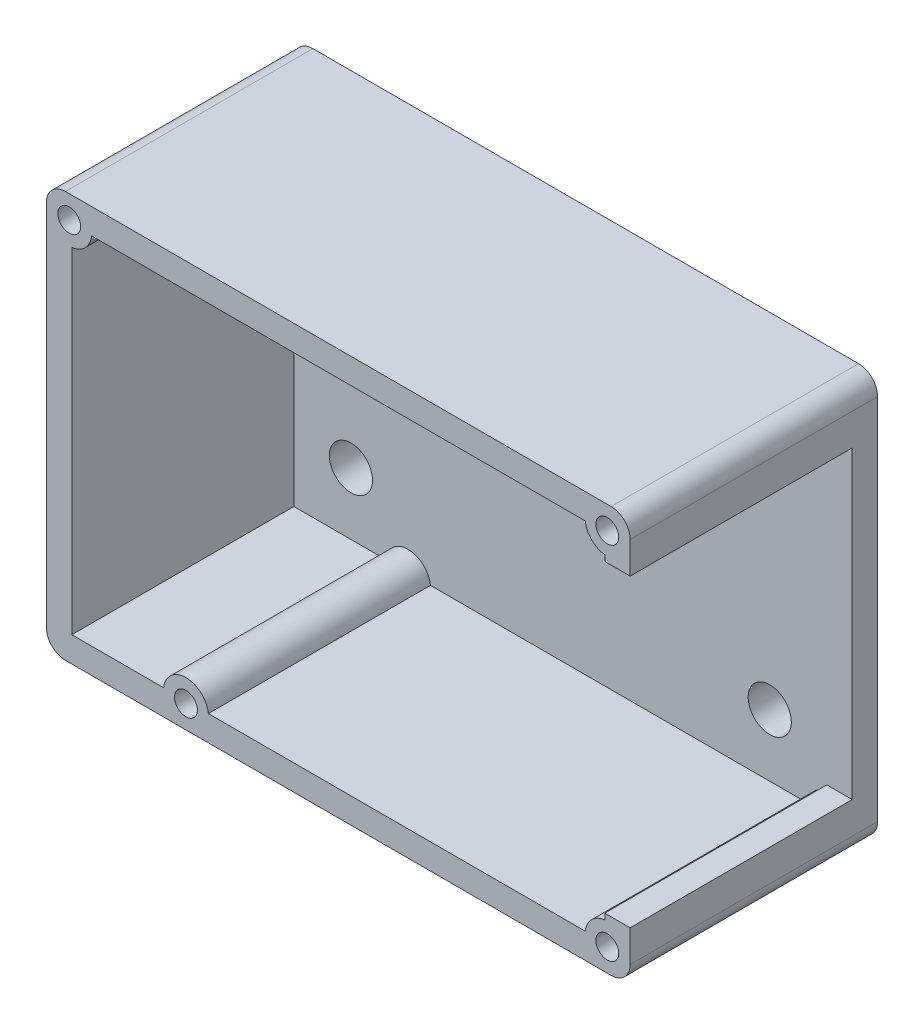
from build123d import *

# Parameters (mm, degrees)
SKETCH2_W                       = 46
SKETCH2_H                       = 32
BOSS_EXTRUDE1_DEPTH             = 19.5
SHELL1_T                        = -2
CBORE_FOR_M3_SBHCS1_AT_2_COUNT  = 2
CBORE_FOR_M3_SBHCS1_AT_2_PITCH  = 18.114862856
CBORE_FOR_M3_SBHCS1_AT_3_COUNT  = 2
CBORE_FOR_M3_SBHCS1_AT_3_PITCH  = 37.645029636
CBORE_FOR_M3_SBHCS1_AT_4_COUNT  = 2
CBORE_FOR_M3_SBHCS1_AT_4_PITCH  = 33
SKETCH8_R                       = 3.35
SKETCH8_R_2                     = 1.7
BOSS_EXTRUDE2_DEPTH             = 3.63
SKETCH9_R                       = 5
BOSS_EXTRUDE3_DEPTH             = 2
SKETCH10_W                      = 17.5
SKETCH10_H                      = 24
CUT_EXTRUDE1_DEPTH              = 2
CBORE_FOR_M1_6_SHCS1_AT_2_COUNT = 2
CBORE_FOR_M1_6_SHCS1_AT_2_PITCH = 42.4
CBORE_FOR_M1_6_SHCS1_AT_3_COUNT = 2
CBORE_FOR_M1_6_SHCS1_AT_3_PITCH = 43.689815747
CBORE_FOR_M1_6_SHCS1_AT_4_COUNT = 2
CBORE_FOR_M1_6_SHCS1_AT_4_PITCH = 28.4
SKETCH14_R                      = 1.75
SKETCH14_R_2                    = 0.9
SKETCH14_R_3                    = 1.775
BOSS_EXTRUDE4_DEPTH             = 17.9
FILLET1_R                       = 1.5


with BuildPart() as part:
    # Sketch2 → Boss-Extrude1 (new body)
    with BuildSketch(Plane.XY):
        with Locations((-23, -16)):
            Rectangle(SKETCH2_W, SKETCH2_H)
    extrude(amount=BOSS_EXTRUDE1_DEPTH)

    # Shell1
    shell1_openings = [part.faces().sort_by_distance(p)[0] for p in [
        (-23, -16, 19.5),
    ]]
    offset(amount=SHELL1_T, openings=shell1_openings, kind=Kind.INTERSECTION)

    # Sketch5 → CBORE for M3 SBHCS1 (revolve, cut)
    with BuildSketch(Plane(origin=(-6.5, -7, 0), x_dir=(0, 1, 0), z_dir=(1, 0, 0))):
        Polygon((0, 0), (0, 3.021463052), (1.7, 2), (1.7, 1.65), (3.35, 1.65), (3.35, 0.025), (3.375, 0), align=None)
    cbore_for_m3_sbhcs1 = revolve(axis=Axis((-6.5, -7, -6.35), (0, 0, 1)), mode=Mode.SUBTRACT)

    # CBORE for M3 SBHCS1 at 2: CBORE for M3 SBHCS1 ×2
    with Locations(*[(0, -i * CBORE_FOR_M3_SBHCS1_AT_2_PITCH, 0) for i in range(1, CBORE_FOR_M3_SBHCS1_AT_2_COUNT)]):
        add(cbore_for_m3_sbhcs1, mode=Mode.SUBTRACT)

    # CBORE for M3 SBHCS1 at 3: CBORE for M3 SBHCS1 ×2
    with Locations(*[Vector(-0.8766097495224606, -0.4812019815443084, 0) * (i * CBORE_FOR_M3_SBHCS1_AT_3_PITCH) for i in range(1, CBORE_FOR_M3_SBHCS1_AT_3_COUNT)]):
        add(cbore_for_m3_sbhcs1, mode=Mode.SUBTRACT)

    # CBORE for M3 SBHCS1 at 4: CBORE for M3 SBHCS1 ×2
    with Locations(*[(-i * CBORE_FOR_M3_SBHCS1_AT_4_PITCH, 0, 0) for i in range(1, CBORE_FOR_M3_SBHCS1_AT_4_COUNT)]):
        add(cbore_for_m3_sbhcs1, mode=Mode.SUBTRACT)

    # Sketch8 → Boss-Extrude2 (add)
    # profile 1 of 4: a face of its own
    with BuildSketch(Plane(origin=(0, 0, 1.65), x_dir=(-1, 0, 0), z_dir=(0, 0, -1))):
        with Locations((6.5, -25.114862856)):
            Circle(SKETCH8_R)
        with Locations((6.5, -25.114862856)):
            Circle(SKETCH8_R_2, mode=Mode.SUBTRACT)
    # profile 2 of 4: a face of its own
    with BuildSketch(Plane(origin=(0, 0, 1.65), x_dir=(-1, 0, 0), z_dir=(0, 0, -1))):
        with Locations((39.5, -25.114862856)):
            Circle(SKETCH8_R)
        with Locations((39.5, -25.114862856)):
            Circle(SKETCH8_R_2, mode=Mode.SUBTRACT)
    # profile 3 of 4: a face of its own
    with BuildSketch(Plane(origin=(0, 0, 1.65), x_dir=(-1, 0, 0), z_dir=(0, 0, -1))):
        with Locations((39.5, -7)):
            Circle(SKETCH8_R)
        with Locations((39.5, -7)):
            Circle(SKETCH8_R_2, mode=Mode.SUBTRACT)
    # profile 4 of 4: a face of its own
    with BuildSketch(Plane(origin=(0, 0, 1.65), x_dir=(-1, 0, 0), z_dir=(0, 0, -1))):
        with Locations((6.5, -7)):
            Circle(SKETCH8_R)
        with Locations((6.5, -7)):
            Circle(SKETCH8_R_2, mode=Mode.SUBTRACT)
    extrude(amount=BOSS_EXTRUDE2_DEPTH)

    # Sketch9 → Boss-Extrude3 (add)
    with BuildSketch(Plane(origin=(0, 0, 0), x_dir=(-1, 0, 0), z_dir=(0, 0, -1))):
        with Locations((15.5, -16)):
            Circle(SKETCH9_R)
    extrude(amount=BOSS_EXTRUDE3_DEPTH)

    # Sketch10 → Cut-Extrude1 (cut)
    with BuildSketch(Plane(origin=(0, 0, 0), x_dir=(0, 0, -1), z_dir=(1, 0, 0))):
        with Locations((-10.75, -16)):
            Rectangle(SKETCH10_W, SKETCH10_H)
    extrude(amount=-CUT_EXTRUDE1_DEPTH, mode=Mode.SUBTRACT)

    # Sketch13 → CBORE for M1.6 SHCS1 (revolve, cut)
    with BuildSketch(Plane(origin=(-1.8, -1.8, 0), x_dir=(0, 1, 0), z_dir=(1, 0, 0))):
        Polygon((0, 0), (0, 19.5), (0.9, 19.5), (0.9, 1.6), (1.75, 1.6), (1.75, 0.025), (1.775, 0), align=None)
    cbore_for_m1_6_shcs1 = revolve(axis=Axis((-1.8, -1.8, -6.35), (0, 0, 1)), mode=Mode.SUBTRACT)

    # CBORE for M1.6 SHCS1 at 2: CBORE for M1.6 SHCS1 ×2
    with Locations(*[(-i * CBORE_FOR_M1_6_SHCS1_AT_2_PITCH, 0, 0) for i in range(1, CBORE_FOR_M1_6_SHCS1_AT_2_COUNT)]):
        add(cbore_for_m1_6_shcs1, mode=Mode.SUBTRACT)

    # CBORE for M1.6 SHCS1 at 3: CBORE for M1.6 SHCS1 ×2
    with Locations(*[Vector(-0.759902495179072, -0.6500370741893268, 0) * (i * CBORE_FOR_M1_6_SHCS1_AT_3_PITCH) for i in range(1, CBORE_FOR_M1_6_SHCS1_AT_3_COUNT)]):
        add(cbore_for_m1_6_shcs1, mode=Mode.SUBTRACT)

    # CBORE for M1.6 SHCS1 at 4: CBORE for M1.6 SHCS1 ×2
    with Locations(*[(0, -i * CBORE_FOR_M1_6_SHCS1_AT_4_PITCH, 0) for i in range(1, CBORE_FOR_M1_6_SHCS1_AT_4_COUNT)]):
        add(cbore_for_m1_6_shcs1, mode=Mode.SUBTRACT)

    # Sketch14 → Boss-Extrude4 (add)
    # profile 1 of 4: a face of its own
    with BuildSketch(Plane(origin=(0, 0, 1.6), x_dir=(-1, 0, 0), z_dir=(0, 0, -1))):
        with Locations((1.8, -1.8)):
            Circle(SKETCH14_R)
        with Locations((1.8, -1.8)):
            Circle(SKETCH14_R_2, mode=Mode.SUBTRACT)
    # profile 2 of 4: a face of its own
    with BuildSketch(Plane(origin=(0, 0, 1.6), x_dir=(-1, 0, 0), z_dir=(0, 0, -1))):
        with Locations((44.2, -1.8)):
            Circle(SKETCH14_R_3)
        with Locations((44.2, -1.8)):
            Circle(SKETCH14_R_2, mode=Mode.SUBTRACT)
    # profile 3 of 4: a face of its own
    with BuildSketch(Plane(origin=(0, 0, 1.6), x_dir=(-1, 0, 0), z_dir=(0, 0, -1))):
        with Locations((35, -30.2)):
            Circle(SKETCH14_R_3)
        with Locations((35, -30.2)):
            Circle(SKETCH14_R_2, mode=Mode.SUBTRACT)
    # profile 4 of 4: a face of its own
    with BuildSketch(Plane(origin=(0, 0, 1.6), x_dir=(-1, 0, 0), z_dir=(0, 0, -1))):
        with Locations((1.8, -30.2)):
            Circle(SKETCH14_R)
        with Locations((1.8, -30.2)):
            Circle(SKETCH14_R_2, mode=Mode.SUBTRACT)
    extrude(amount=-BOSS_EXTRUDE4_DEPTH)

    # Fillet1
    fillet1_edges = [part.edges().sort_by_distance(p)[0] for p in [
        (0, -32, 9.75),
        (-46, -32, 9.75),
        (-46, 0, 9.75),
        (0, 0, 9.75),
    ]]
    fillet(fillet1_edges, radius=FILLET1_R)


solid = part.part
